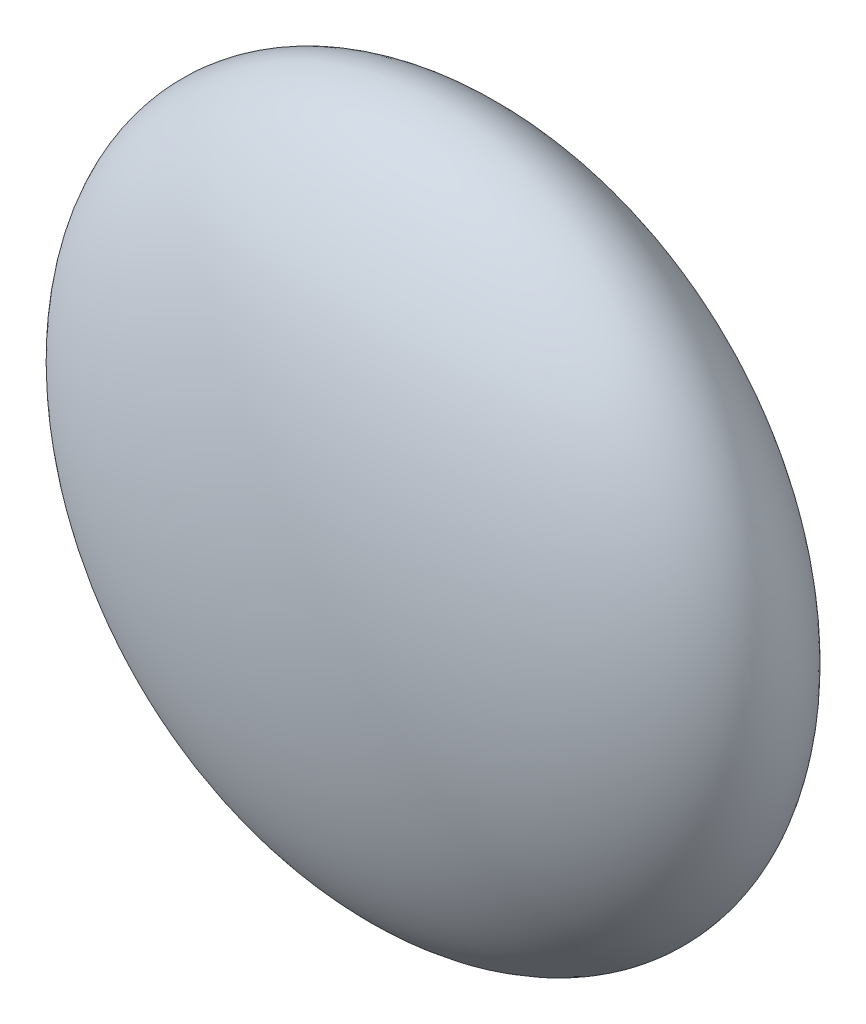
from build123d import *


with BuildPart() as part:
    # Sketch1 → Revolve1 (revolve)
    with BuildSketch(Plane(origin=(0, 0, 0), x_dir=(0, 0, -1), z_dir=(1, 0, 0))):
        with BuildLine():
            Line((-0.242, 0), (0.242, 0))
            add(Edge.make_bspline(
                [(0.242, 0), (0.242, 0.55), (0, 0.55), (-0.242, 0.55), (-0.242, 0)],
                knots=[4.71238898, 4.71238898, 4.71238898, 6.283185307, 6.283185307, 7.853981634, 7.853981634, 7.853981634], degree=2, weights=[1, 0.707106781, 1, 0.707106781, 1]))
        make_face()
    revolve(axis=Axis((0, 0, 0.242), (0, 0, -1)))


solid = part.part
